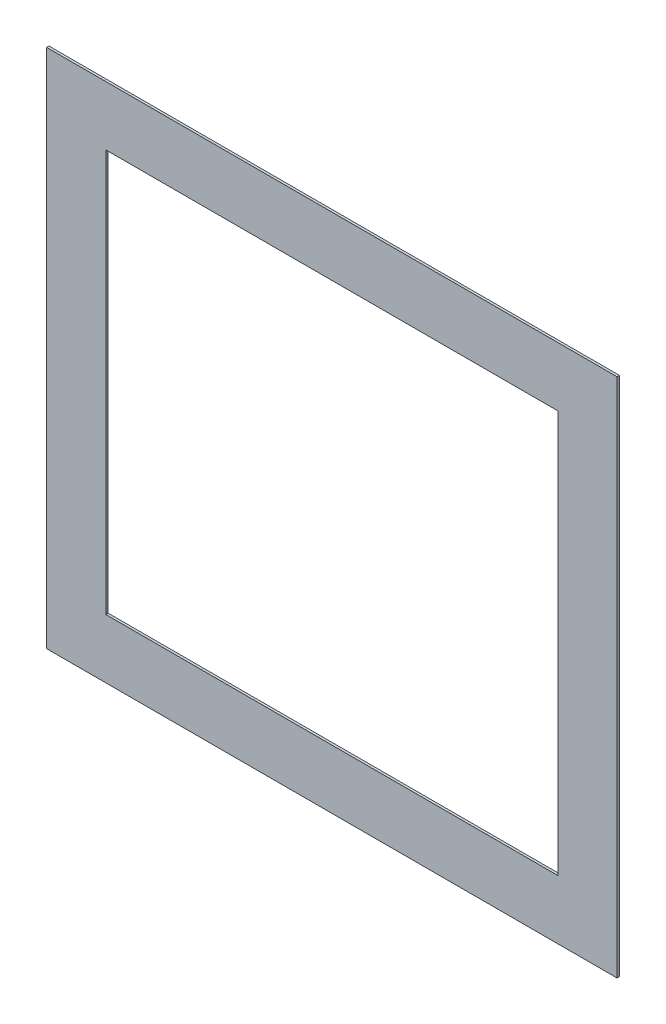
from build123d import *

# Parameters (mm, degrees)
SKETCH_1_W      = 48.2
SKETCH_1_H      = 44
SKETCH_1_W_2    = 38.2
SKETCH_1_H_2    = 34
EXTRUDE_1_DEPTH = 0.2


with BuildPart() as part:
    # 스케치1 → 보스-돌출1 (new body)
    with BuildSketch(Plane.XY):
        with Locations((24.1, 22)):
            Rectangle(SKETCH_1_W, SKETCH_1_H)
        with Locations((24.1, 22)):
            Rectangle(SKETCH_1_W_2, SKETCH_1_H_2, mode=Mode.SUBTRACT)
    extrude(amount=EXTRUDE_1_DEPTH)


solid = part.part
